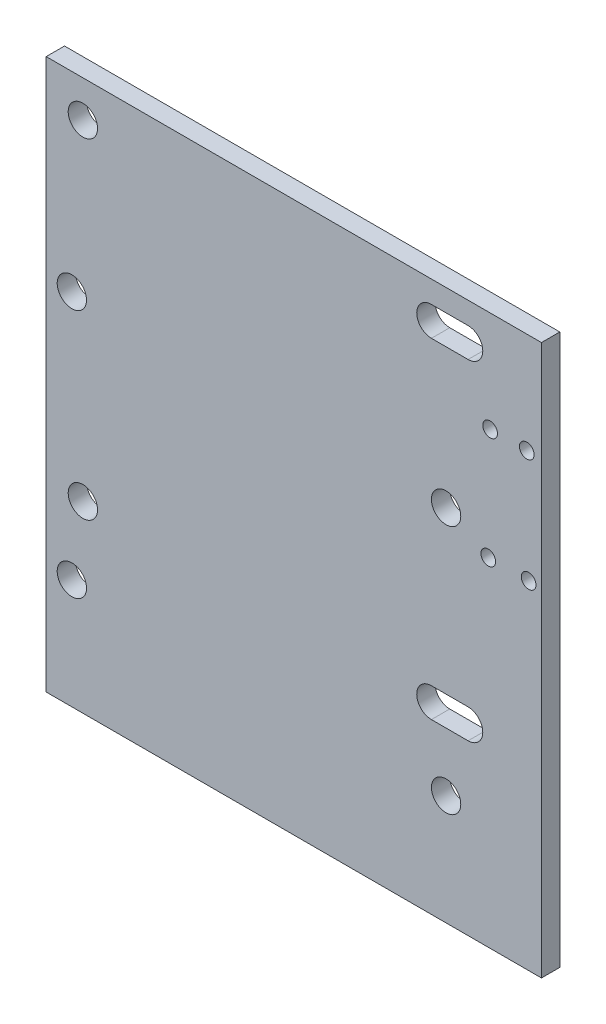
from build123d import *

# Parameters (mm, degrees)
SKETCH1_W           = 135
SKETCH1_H           = 150
BOSS_EXTRUDE1_DEPTH = 5
CUT_EXTRUDE1_REACH  = 103.026
SKETCH2_R           = 4
CUT_EXTRUDE5_REACH  = 103.026
SKETCH6_R           = 4
CUT_EXTRUDE6_REACH  = 103.026
SKETCH7_R           = 2


with BuildPart() as part:
    # Sketch1 → Boss-Extrude1 (new body)
    with BuildSketch(Plane.XY):
        Rectangle(SKETCH1_W, SKETCH1_H)
    extrude(amount=BOSS_EXTRUDE1_DEPTH)

    # Sketch2 → Cut-Extrude1 (cut, up to next)
    with BuildSketch(Plane.XY.offset(5), mode=Mode.PRIVATE) as cut_extrude1_sk1:
        with Locations((-57.5, 65)):
            Circle(SKETCH2_R)
    cut_extrude1_tool1 = extrude(cut_extrude1_sk1.sketch, amount=-CUT_EXTRUDE1_REACH, mode=Mode.PRIVATE) & part.part
    # Sketch2 → Cut-Extrude1 (cut, up to next)
    with BuildSketch(Plane.XY.offset(5), mode=Mode.PRIVATE) as cut_extrude1_sk2:
        with Locations((-57.5, -25)):
            Circle(SKETCH2_R)
    cut_extrude1_tool2 = extrude(cut_extrude1_sk2.sketch, amount=-CUT_EXTRUDE1_REACH, mode=Mode.PRIVATE) & part.part
    # Sketch2 → Cut-Extrude1 (cut, up to next)
    with BuildSketch(Plane.XY.offset(5), mode=Mode.PRIVATE) as cut_extrude1_sk3:
        with BuildLine():
            Line((37.5, 69), (47.5, 69))
            ThreePointArc((47.5, 69), (51.5, 65), (47.5, 61))
            Line((47.5, 61), (37.5, 61))
            ThreePointArc((37.5, 61), (33.5, 65), (37.5, 69))
        make_face()
    cut_extrude1_tool3 = extrude(cut_extrude1_sk3.sketch, amount=-CUT_EXTRUDE1_REACH, mode=Mode.PRIVATE) & part.part
    # Sketch2 → Cut-Extrude1 (cut, up to next)
    with BuildSketch(Plane.XY.offset(5), mode=Mode.PRIVATE) as cut_extrude1_sk4:
        with BuildLine():
            Line((37.5, -29), (47.5, -29))
            ThreePointArc((47.5, -29), (51.5, -25), (47.5, -21))
            Line((47.5, -21), (37.5, -21))
            ThreePointArc((37.5, -21), (33.5, -25), (37.5, -29))
        make_face()
    cut_extrude1_tool4 = extrude(cut_extrude1_sk4.sketch, amount=-CUT_EXTRUDE1_REACH, mode=Mode.PRIVATE) & part.part
    add(cut_extrude1_tool1.solids().sort_by_distance((-57.5, 65, 5))[0], mode=Mode.SUBTRACT)
    add(cut_extrude1_tool2.solids().sort_by_distance((-57.5, -25, 5))[0], mode=Mode.SUBTRACT)
    add(cut_extrude1_tool3.solids().sort_by_distance((42.5, 65, 5))[0], mode=Mode.SUBTRACT)
    add(cut_extrude1_tool4.solids().sort_by_distance((42.5, -25, 5))[0], mode=Mode.SUBTRACT)

    # Sketch6 → Cut-Extrude5 (cut, up to next)
    with BuildSketch(Plane.XY.offset(5), mode=Mode.PRIVATE) as cut_extrude5_sk1:
        with Locations((-60.5, 23)):
            Circle(SKETCH6_R)
    cut_extrude5_tool1 = extrude(cut_extrude5_sk1.sketch, amount=-CUT_EXTRUDE5_REACH, mode=Mode.PRIVATE) & part.part
    # Sketch6 → Cut-Extrude5 (cut, up to next)
    with BuildSketch(Plane.XY.offset(5), mode=Mode.PRIVATE) as cut_extrude5_sk2:
        with Locations((-60.5, -45)):
            Circle(SKETCH6_R)
    cut_extrude5_tool2 = extrude(cut_extrude5_sk2.sketch, amount=-CUT_EXTRUDE5_REACH, mode=Mode.PRIVATE) & part.part
    # Sketch6 → Cut-Extrude5 (cut, up to next)
    with BuildSketch(Plane.XY.offset(5), mode=Mode.PRIVATE) as cut_extrude5_sk3:
        with Locations((41.5, 23)):
            Circle(SKETCH6_R)
    cut_extrude5_tool3 = extrude(cut_extrude5_sk3.sketch, amount=-CUT_EXTRUDE5_REACH, mode=Mode.PRIVATE) & part.part
    # Sketch6 → Cut-Extrude5 (cut, up to next)
    with BuildSketch(Plane.XY.offset(5), mode=Mode.PRIVATE) as cut_extrude5_sk4:
        with Locations((41.5, -45)):
            Circle(SKETCH6_R)
    cut_extrude5_tool4 = extrude(cut_extrude5_sk4.sketch, amount=-CUT_EXTRUDE5_REACH, mode=Mode.PRIVATE) & part.part
    add(cut_extrude5_tool1.solids().sort_by_distance((-60.5, 23, 5))[0], mode=Mode.SUBTRACT)
    add(cut_extrude5_tool2.solids().sort_by_distance((-60.5, -45, 5))[0], mode=Mode.SUBTRACT)
    add(cut_extrude5_tool3.solids().sort_by_distance((41.5, 23, 5))[0], mode=Mode.SUBTRACT)
    add(cut_extrude5_tool4.solids().sort_by_distance((41.5, -45, 5))[0], mode=Mode.SUBTRACT)

    # Sketch7 → Cut-Extrude6 (cut, up to next)
    with BuildSketch(Plane(origin=(0, 0, 0), x_dir=(-1, 0, 0), z_dir=(0, 0, -1)), mode=Mode.PRIVATE) as cut_extrude6_sk1:
        with Locations((-63.5, 47.5)):
            Circle(SKETCH7_R)
    cut_extrude6_tool1 = extrude(cut_extrude6_sk1.sketch, amount=-CUT_EXTRUDE6_REACH, mode=Mode.PRIVATE) & part.part
    # Sketch7 → Cut-Extrude6 (cut, up to next)
    with BuildSketch(Plane(origin=(0, 0, 0), x_dir=(-1, 0, 0), z_dir=(0, 0, -1)), mode=Mode.PRIVATE) as cut_extrude6_sk2:
        with Locations((-53.5, 47.5)):
            Circle(SKETCH7_R)
    cut_extrude6_tool2 = extrude(cut_extrude6_sk2.sketch, amount=-CUT_EXTRUDE6_REACH, mode=Mode.PRIVATE) & part.part
    # Sketch7 → Cut-Extrude6 (cut, up to next)
    with BuildSketch(Plane(origin=(0, 0, 0), x_dir=(-1, 0, 0), z_dir=(0, 0, -1)), mode=Mode.PRIVATE) as cut_extrude6_sk3:
        with Locations((-64, 17)):
            Circle(SKETCH7_R)
    cut_extrude6_tool3 = extrude(cut_extrude6_sk3.sketch, amount=-CUT_EXTRUDE6_REACH, mode=Mode.PRIVATE) & part.part
    # Sketch7 → Cut-Extrude6 (cut, up to next)
    with BuildSketch(Plane(origin=(0, 0, 0), x_dir=(-1, 0, 0), z_dir=(0, 0, -1)), mode=Mode.PRIVATE) as cut_extrude6_sk4:
        with Locations((-53, 17)):
            Circle(SKETCH7_R)
    cut_extrude6_tool4 = extrude(cut_extrude6_sk4.sketch, amount=-CUT_EXTRUDE6_REACH, mode=Mode.PRIVATE) & part.part
    add(cut_extrude6_tool1.solids().sort_by_distance((63.5, 47.5, 0))[0], mode=Mode.SUBTRACT)
    add(cut_extrude6_tool2.solids().sort_by_distance((53.5, 47.5, 0))[0], mode=Mode.SUBTRACT)
    add(cut_extrude6_tool3.solids().sort_by_distance((64, 17, 0))[0], mode=Mode.SUBTRACT)
    add(cut_extrude6_tool4.solids().sort_by_distance((53, 17, 0))[0], mode=Mode.SUBTRACT)


solid = part.part
